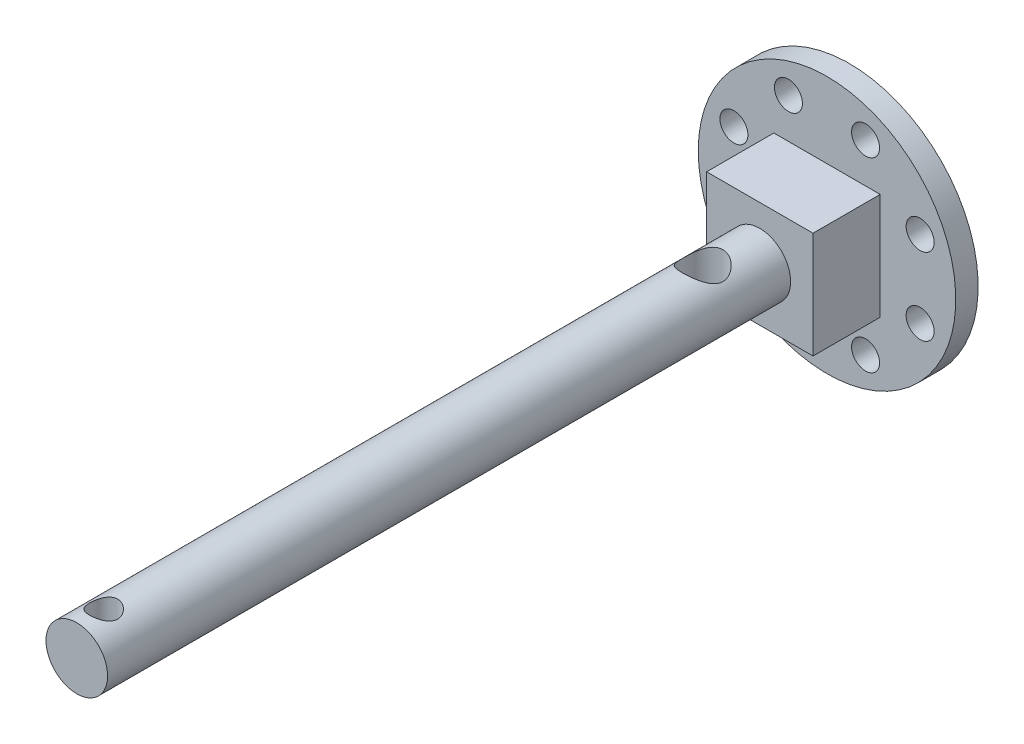
from build123d import *

# Parameters (mm, degrees)
SKETCH_1_R           = 2.75
EXTRUDE_1_DEPTH      = 1
SKETCH_3_W           = 9.5
SKETCH_3_H           = 9.5
EXTRUDE_2_DEPTH      = 6
SKETCH_12_W          = 9.5
SKETCH_12_H          = 9.5
EXTRUDE_5_DEPTH      = 45
SKETCH_15_W          = 5.9
SKETCH_15_H          = 20.04910328
EXTRUDE_6_DEPTH      = 6
SKETCH_17_R          = 1.8
CUT_EXTRUDE_9_DEPTH  = 5
SKETCH_18_OUTSIDE_W  = 23.92
SKETCH_18_OUTSIDE_H  = 34.47
SKETCH_18_OUTSIDE_R  = 2.75
CUT_EXTRUDE_10_DEPTH = 60
SKETCH_19_R          = 11.5
EXTRUDE_7_DEPTH      = 2
SKETCH_20_R          = 1.25
CUT_EXTRUDE_11_DEPTH = 2
SKETCH_21_R          = 4.5
CUT_EXTRUDE_13_DEPTH = 5.4
SKETCH_22_R          = 2.75
EXTRUDE_8_DEPTH      = 12
CUT_EXTRUDE_START    = -3
SKETCH_24_R          = 2.75
CUT_EXTRUDE_15_DEPTH = 3
SKETCH_25_R          = 1.25
CUT_EXTRUDE_16_DEPTH = 9


with BuildPart() as part:
    # 스케치1 → 보스-돌출1 (new body)
    with BuildSketch(Plane.XY):
        Circle(SKETCH_1_R)
    extrude(amount=EXTRUDE_1_DEPTH)

    # 스케치3 → 보스-돌출2 (add)
    with BuildSketch(Plane(origin=(0, 0, 0), x_dir=(-1, 0, 0), z_dir=(0, 0, -1))):
        Rectangle(SKETCH_3_W, SKETCH_3_H)
    extrude(amount=EXTRUDE_2_DEPTH)

    # 스케치12 → 보스-돌출5 (add)
    with BuildSketch(Plane.XY.offset(1)):
        Rectangle(SKETCH_12_W, SKETCH_12_H)
    extrude(amount=EXTRUDE_5_DEPTH)

    # 스케치15 → 보스-돌출6 (add)
    with BuildSketch(Plane.XY.offset(46)):
        Rectangle(SKETCH_15_W, SKETCH_15_H)
    extrude(amount=EXTRUDE_6_DEPTH)

    # 스케치17 → 컷-돌출9 (cut)
    with BuildSketch(Plane(origin=(0, 4.75, 0), x_dir=(1, 0, 0), z_dir=(0, 1, 0))):
        with Locations(Location((0, -5.1, 0), (0, 0, 180))):
            Circle(SKETCH_17_R)
    extrude(amount=-CUT_EXTRUDE_9_DEPTH, mode=Mode.SUBTRACT)

    # 스케치18 outside → 컷-돌출10 (cut)
    with BuildSketch(Plane(origin=(0, 0, 1), x_dir=(-1, 0, 0), z_dir=(0, 0, -1))):
        Rectangle(SKETCH_18_OUTSIDE_W, SKETCH_18_OUTSIDE_H)
        Circle(SKETCH_18_OUTSIDE_R, mode=Mode.SUBTRACT)
    extrude(amount=-CUT_EXTRUDE_10_DEPTH, mode=Mode.SUBTRACT)

    # 스케치19 → 보스-돌출7 (add)
    with BuildSketch(Plane(origin=(0, 0, -6), x_dir=(-1, 0, 0), z_dir=(0, 0, -1))):
        Circle(SKETCH_19_R)
    extrude(amount=EXTRUDE_7_DEPTH)

    # 스케치20 → 컷-돌출11 (cut)
    with BuildSketch(Plane.XY.offset(-6)):
        with Locations((3.444150891, 8.314915793)):
            Circle(SKETCH_20_R)
        with Locations((8.314915793, 3.444150891)):
            Circle(SKETCH_20_R)
        with Locations((8.314915793, -3.444150891)):
            Circle(SKETCH_20_R)
        with Locations((3.444150891, -8.314915793)):
            Circle(SKETCH_20_R)
        with Locations((-3.444150891, -8.314915793)):
            Circle(SKETCH_20_R)
        with Locations((-8.314915793, -3.444150891)):
            Circle(SKETCH_20_R)
        with Locations((-8.314915793, 3.444150891)):
            Circle(SKETCH_20_R)
        with Locations((-3.444150891, 8.314915793)):
            Circle(SKETCH_20_R)
    extrude(amount=-CUT_EXTRUDE_11_DEPTH, mode=Mode.SUBTRACT)

    # 스케치21 → 컷-돌출13 (cut)
    with BuildSketch(Plane(origin=(0, 0, -8), x_dir=(-1, 0, 0), z_dir=(0, 0, -1))):
        Circle(SKETCH_21_R)
    extrude(amount=-CUT_EXTRUDE_13_DEPTH, mode=Mode.SUBTRACT)

    # 스케치22 → 보스-돌출8 (add)
    with BuildSketch(Plane.XY.offset(52)):
        with Locations(Location((0, 0, 0), (0, 0, 180))):
            Circle(SKETCH_22_R)
    extrude(amount=EXTRUDE_8_DEPTH)

    # 스케치24 → 컷-돌출15 (cut)
    with BuildSketch(Plane.XY.offset(64).offset(CUT_EXTRUDE_START)):
        with Locations(Location((0, 0, 0), (0, 0, 180))):
            Circle(SKETCH_24_R)
    extrude(amount=CUT_EXTRUDE_15_DEPTH, mode=Mode.SUBTRACT)

    # 스케치25 → 컷-돌출16 (cut)
    with BuildSketch(Plane(origin=(0, 2.75, 0), x_dir=(1, 0, 0), z_dir=(0, 1, 0))):
        with Locations(Location((0, -58.6, 0), (0, 0, 270))):
            Circle(SKETCH_25_R)
    extrude(amount=-CUT_EXTRUDE_16_DEPTH, mode=Mode.SUBTRACT)


solid = part.part
